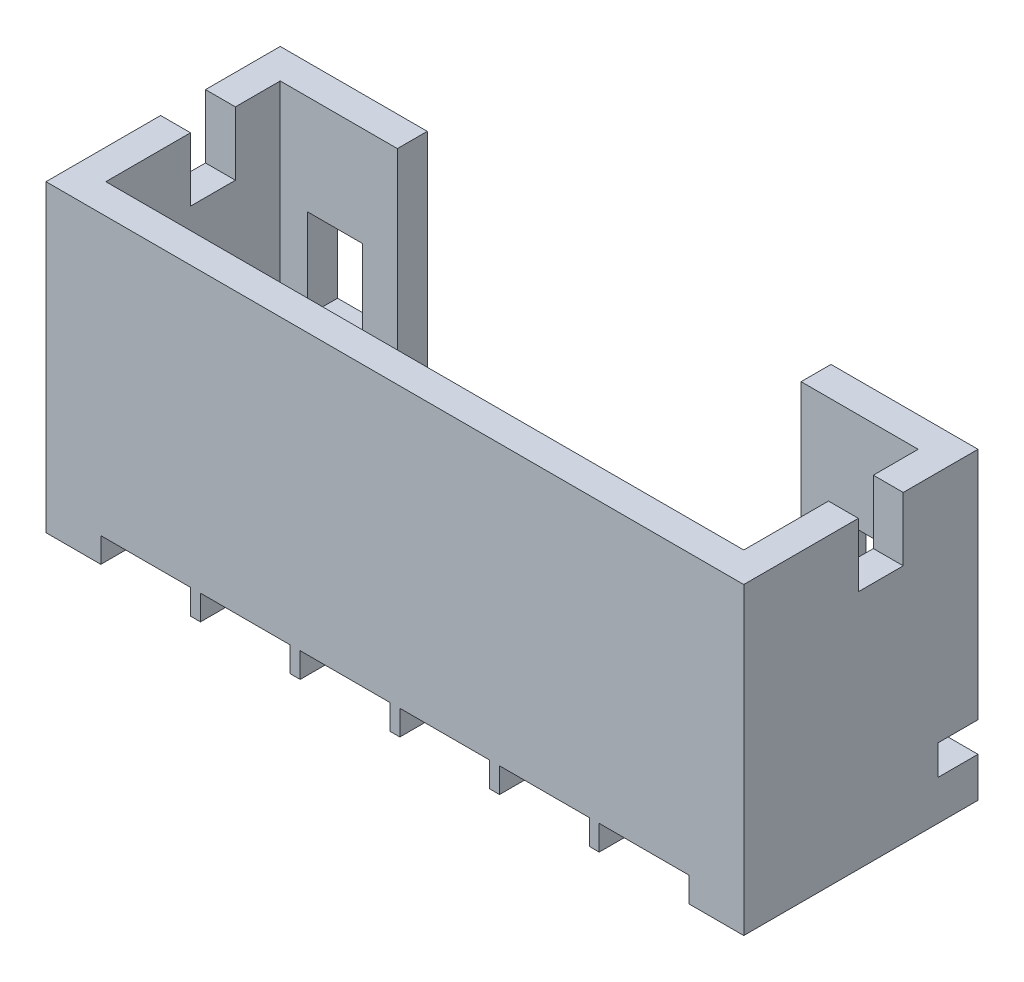
from build123d import *

# Parameters (mm, degrees)
ESBO_O1_W                  = 14
ESBO_O1_H                  = 4.7
RESSALTO_EXTRUS_O1_DEPTH   = 3.05
CASCA1_T                   = -0.6
ESBO_O2_W                  = 8.1
ESBO_O2_H                  = 4.4
ESBO_O2_W_2                = 1.1
ESBO_O2_H_2                = 1.8
CORTE_EXTRUS_O1_DEPTH      = 0.6
ESBO_O3_W                  = 12.8
ESBO_O3_H                  = 3.5
RESSALTO_EXTRUS_O2_DEPTH   = 1.1
ESBO_O4_W                  = 14
ESBO_O4_H                  = 0.6
CORTE_EXTRUS_O2_DEPTH      = 0.8
CORTE_EXTRUS_O3_DEPTH      = 15.519814048
CORTE_EXTRUS_O3_DEPTH_BACK = 15.519814048
ESBO_O5_W                  = 0.9
ESBO_O5_H                  = 1.275071612
ESBO_O8_W                  = 0.5
ESBO_O8_H                  = 0.5
CORTE_EXTRUS_O5_DEPTH      = 10.577708494
ESBO_O9_W                  = 1.8
ESBO_O9_H                  = 4.707525417
ESBO_O9_H_2                = 4.692474583
CORTE_EXTRUS_O6_DEPTH      = 0.5
ESBO_O10_W                 = 1.8
ESBO_O10_H                 = 0.5
CORTE_EXTRUS_O7_DEPTH      = 9.962244011


with BuildPart() as part:
    # Esboço1 → Ressalto-extrusão1 (new, symmetric)
    with BuildSketch(Plane(origin=(0, 0, 0), x_dir=(1, 0, 0), z_dir=(0, 1, 0))):
        Rectangle(ESBO_O1_W, ESBO_O1_H)
    extrude(amount=RESSALTO_EXTRUS_O1_DEPTH, both=True)

    # Casca1
    casca1_openings = [part.faces().sort_by_distance(p)[0] for p in [
        (0, 3.05, 0),
    ]]
    offset(amount=CASCA1_T, openings=casca1_openings, kind=Kind.INTERSECTION)

    # Esboço2 → Corte-extrusão1 (cut)
    with BuildSketch(Plane(origin=(0, 0, -2.35), x_dir=(-1, 0, 0), z_dir=(0, 0, -1))):
        with Locations((0, 0.85)):
            Rectangle(ESBO_O2_W, ESBO_O2_H)
        with Locations((5.3, 0.15)):
            Rectangle(ESBO_O2_W_2, ESBO_O2_H_2)
        with Locations((-5.3, 0.15)):
            Rectangle(ESBO_O2_W_2, ESBO_O2_H_2)
    extrude(amount=-CORTE_EXTRUS_O1_DEPTH, mode=Mode.SUBTRACT)

    # Esboço3 → Ressalto-extrusão2 (add)
    with BuildSketch(Plane(origin=(0, -2.45, 0), x_dir=(1, 0, 0), z_dir=(0, 1, 0))):
        Rectangle(ESBO_O3_W, ESBO_O3_H)
    extrude(amount=RESSALTO_EXTRUS_O2_DEPTH)

    # Esboço4 → Corte-extrusão2 (cut)
    with BuildSketch(Plane(origin=(0, 0, -2.35), x_dir=(-1, 0, 0), z_dir=(0, 0, -1))):
        with Locations((0, -1.95)):
            Rectangle(ESBO_O4_W, ESBO_O4_H)
    extrude(amount=-CORTE_EXTRUS_O2_DEPTH, mode=Mode.SUBTRACT)

    # Esboço5 → Corte-extrusão3 (cut, two sides: drawn at the far end of the back side and taken through both)
    with BuildSketch(Plane(origin=(7, 0, 0), x_dir=(0, 0, -1), z_dir=(1, 0, 0)).offset(-CORTE_EXTRUS_O3_DEPTH_BACK)):
        with Locations((0.4, 2.412464194)):
            Rectangle(ESBO_O5_W, ESBO_O5_H)
    extrude(amount=CORTE_EXTRUS_O3_DEPTH + CORTE_EXTRUS_O3_DEPTH_BACK, mode=Mode.SUBTRACT)

    # Esboço8 → Corte-extrusão5 (cut, through all)
    with BuildSketch(Plane.XZ.offset(3.05)):
        with Locations((-3, 0)):
            Rectangle(ESBO_O8_W, ESBO_O8_H)
        with Locations((-5, 0)):
            Rectangle(ESBO_O8_W, ESBO_O8_H)
        with Locations((-1, 0)):
            Rectangle(ESBO_O8_W, ESBO_O8_H)
        with Locations((1, 0)):
            Rectangle(ESBO_O8_W, ESBO_O8_H)
        with Locations((3, 0)):
            Rectangle(ESBO_O8_W, ESBO_O8_H)
        with Locations((5, 0)):
            Rectangle(ESBO_O8_W, ESBO_O8_H)
    extrude(amount=-CORTE_EXTRUS_O5_DEPTH, mode=Mode.SUBTRACT)

    # Esboço9 → Corte-extrusão6 (cut)
    with BuildSketch(Plane.XZ.offset(3.05)):
        with Locations((-4.999992921, 0.003762709)):
            Rectangle(ESBO_O9_W, ESBO_O9_H)
        with Locations((-2.999992921, 0.003762709)):
            Rectangle(ESBO_O9_W, ESBO_O9_H)
        with Locations((-0.999992921, 0.003762709)):
            Rectangle(ESBO_O9_W, ESBO_O9_H)
        with Locations((0.999992921, 0.003762709)):
            Rectangle(ESBO_O9_W, ESBO_O9_H)
        with Locations((2.999992921, 0.003762709)):
            Rectangle(ESBO_O9_W, ESBO_O9_H)
        with Locations((4.999992921, 0.003762709)):
            Rectangle(ESBO_O9_W, ESBO_O9_H_2)
    extrude(amount=-CORTE_EXTRUS_O6_DEPTH, mode=Mode.SUBTRACT)

    # Esboço10 → Corte-extrusão7 (cut, through all)
    with BuildSketch(Plane.XY.offset(-2.342474583)):
        with Locations((4.999992921, -2.8)):
            Rectangle(ESBO_O10_W, ESBO_O10_H)
    extrude(amount=-CORTE_EXTRUS_O7_DEPTH, mode=Mode.SUBTRACT)


solid = part.part
